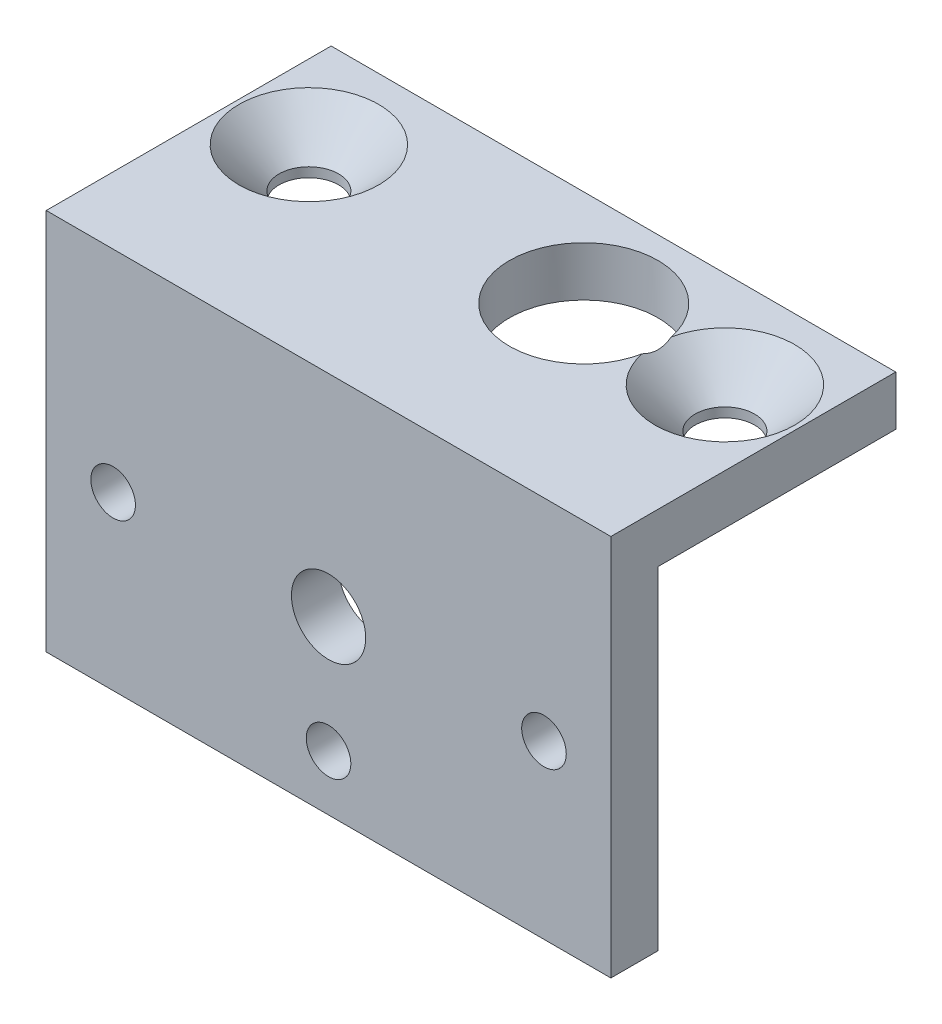
from build123d import *

# Parameters (mm, degrees)
SKETCH1_W                                            = 38.00356671
SKETCH1_H                                            = 25.735371596
SKETCH1_R                                            = 1.5
SKETCH1_R_2                                          = 2.5
BOSS_EXTRUDE1_DEPTH                                  = 3.175
SKETCH2_W                                            = 38.00356671
SKETCH2_H                                            = 3.342685798
BOSS_EXTRUDE2_DEPTH                                  = 16
SKETCH3_R                                            = 5
SKETCH3_R_2                                          = 2
CUT_EXTRUDE1_DEPTH                                   = 10
ESCAREADO_PARA_PARAFUSO_DE_M_QUINA_COM_C_D           = 4
ESCAREADO_PARA_PARAFUSO_DE_M_QUINA_COM_C_CSINK_D     = 9.4
ESCAREADO_PARA_PARAFUSO_DE_M_QUINA_COM_C_CSINK_ANGLE = 90


with BuildPart() as part:
    # Sketch1 → Boss-Extrude1 (new body)
    with BuildSketch(Plane.XY):
        Rectangle(SKETCH1_W, SKETCH1_H)
        with Locations((-14.5, -1.307314202)):
            Circle(SKETCH1_R, mode=Mode.SUBTRACT)
        with Locations((14.5, -1.307314202)):
            Circle(SKETCH1_R, mode=Mode.SUBTRACT)
        with Locations((0, -1.307314202)):
            Circle(SKETCH1_R_2, mode=Mode.SUBTRACT)
        with Locations((0, -9.132314202)):
            Circle(SKETCH1_R, mode=Mode.SUBTRACT)
    extrude(amount=BOSS_EXTRUDE1_DEPTH)

    # Sketch2 → Boss-Extrude2 (add)
    with BuildSketch(Plane(origin=(0, 0, 0), x_dir=(-1, 0, 0), z_dir=(0, 0, -1))):
        with Locations((0, 11.196342899)):
            Rectangle(SKETCH2_W, SKETCH2_H)
    extrude(amount=BOSS_EXTRUDE2_DEPTH)

    # Sketch3 → Cut-Extrude1 (cut)
    with BuildSketch(Plane.XZ.offset(-9.525)):
        with Locations((4.5, -9.5)):
            Circle(SKETCH3_R)
        with Locations((-14, -9.5)):
            Circle(SKETCH3_R_2)
        with Locations((14, -9.5)):
            Circle(SKETCH3_R_2)
    extrude(amount=-CUT_EXTRUDE1_DEPTH, mode=Mode.SUBTRACT)

    # Escareado para parafuso de máquina com cabeça chata de M42 (through all)
    with Locations(Plane(origin=(0, 12.867685798, 0), x_dir=(-1, 0, 0), z_dir=(0, 1, 0))):
        with Locations((14, -9.5), (-14, -9.5)):
            CounterSinkHole(ESCAREADO_PARA_PARAFUSO_DE_M_QUINA_COM_C_D / 2, ESCAREADO_PARA_PARAFUSO_DE_M_QUINA_COM_C_CSINK_D / 2, counter_sink_angle=ESCAREADO_PARA_PARAFUSO_DE_M_QUINA_COM_C_CSINK_ANGLE)


solid = part.part
